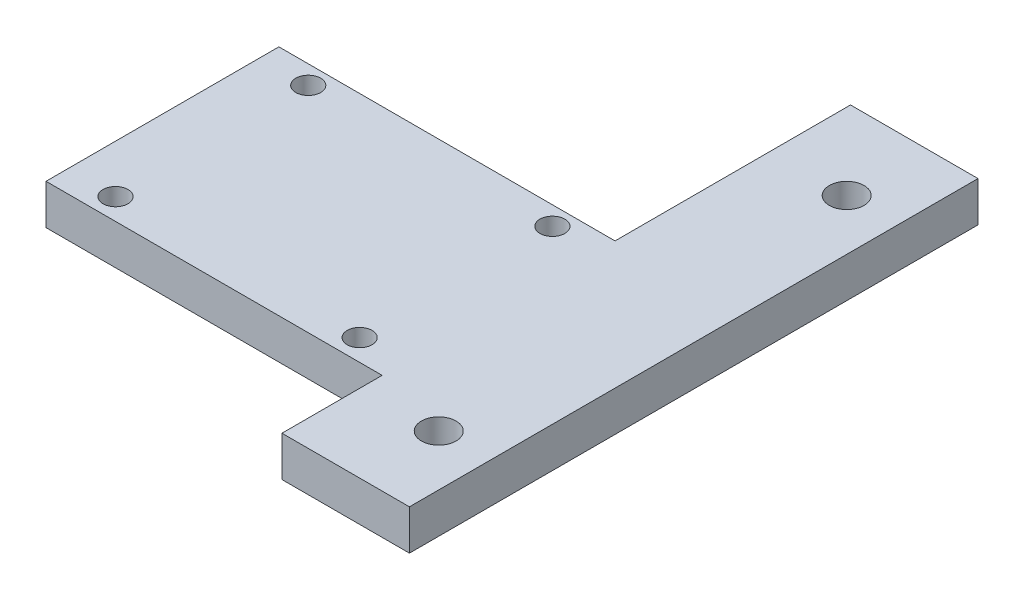
from build123d import *

# Parameters (mm, degrees)
SKETCH1_R           = 2.159
SKETCH1_R_2         = 1.55
BOSS_EXTRUDE1_DEPTH = 5


with BuildPart() as part:
    # Sketch1 → Boss-Extrude1 (new body)
    with BuildSketch(Plane(origin=(0, 0, 0), x_dir=(1, 0, 0), z_dir=(0, 1, 0))):
        Polygon((36.55, 27.14922), (36.55, -43.65078), (20.675, -43.65078), (20.675, -31.173955128), (-21.18269604, -31.173955128), (-21.18269604, -2.173955128), (20.675, -2.173955128), (20.675, 27.14922), align=None)
        with Locations(Location((30.2, -33.65078, 0), (0, 0, 90))):
            Circle(SKETCH1_R, mode=Mode.SUBTRACT)
        with Locations(Location((-15.2, -28.50156, 0), (0, 0, 90))):
            Circle(SKETCH1_R_2, mode=Mode.SUBTRACT)
        with Locations(Location((15.19999, -28.50156, 0), (0, 0, 270))):
            Circle(SKETCH1_R_2, mode=Mode.SUBTRACT)
        with Locations(Location((-15.2, -4.50156, 0), (0, 0, 270))):
            Circle(SKETCH1_R_2, mode=Mode.SUBTRACT)
        with Locations(Location((15.2, -4.50156, 0), (0, 0, 90))):
            Circle(SKETCH1_R_2, mode=Mode.SUBTRACT)
        with Locations(Location((30.2, 17.14922, 0), (0, 0, 270))):
            Circle(SKETCH1_R, mode=Mode.SUBTRACT)
    extrude(amount=BOSS_EXTRUDE1_DEPTH)


solid = part.part
